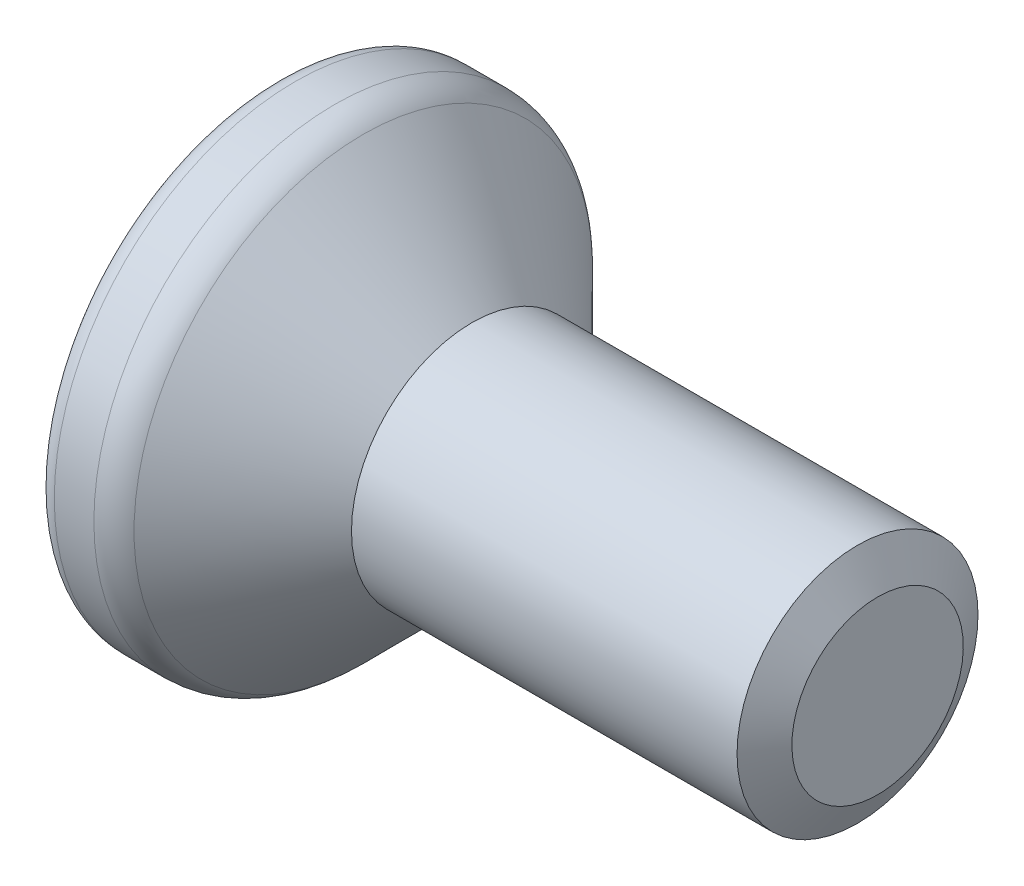
from build123d import *

# Parameters (mm, degrees)
FILLET_1_R          = 0.5
FILLET_2_R          = 1
CUT_EXTRUDE_1_DEPTH = 2.5
CHAMFER_1_SIZE      = 0.5
CHAMFER_1_SIZE2     = 0.866025404


with BuildPart() as part:
    # 草图1 → 旋转1 (revolve)
    with BuildSketch(Plane.XY):
        Polygon((7.5, 0), (-7.5, 0), (-7.5, 6), (-5.6, 6), (-2.6, 3), (7.5, 3), align=None)
    revolve(axis=Axis((7.5, 0, 0), (-1, 0, 0)))

    # 圆角1
    fillet_1_edges = [part.edges().sort_by_distance(p)[0] for p in [
        (-7.5, -6, 0),
    ]]
    fillet(fillet_1_edges, radius=FILLET_1_R)

    # 圆角2
    fillet_2_edges = [part.edges().sort_by_distance(p)[0] for p in [
        (-5.6, -6, 0),
    ]]
    fillet(fillet_2_edges, radius=FILLET_2_R)

    # 草图2 → 切除-拉伸1 (cut)
    with BuildSketch(Plane.ZY.offset(7.5)):
        Polygon((0, 2.309401077), (-2, 1.154700538), (-2, -1.154700538), (0, -2.309401077), (2, -1.154700538), (2, 1.154700538), align=None)
    extrude(amount=-CUT_EXTRUDE_1_DEPTH, mode=Mode.SUBTRACT)

    # 倒角1
    chamfer_1_edges = [part.edges().sort_by_distance(p)[0] for p in [
        (7.5, -3, 0),
    ]]
    chamfer_1_side = [part.faces().sort_by_distance(p)[0] for p in [
        (2.45, -3, 0),
    ]]
    chamfer(chamfer_1_edges, length=CHAMFER_1_SIZE, length2=CHAMFER_1_SIZE2, reference=chamfer_1_side[0])


solid = part.part
